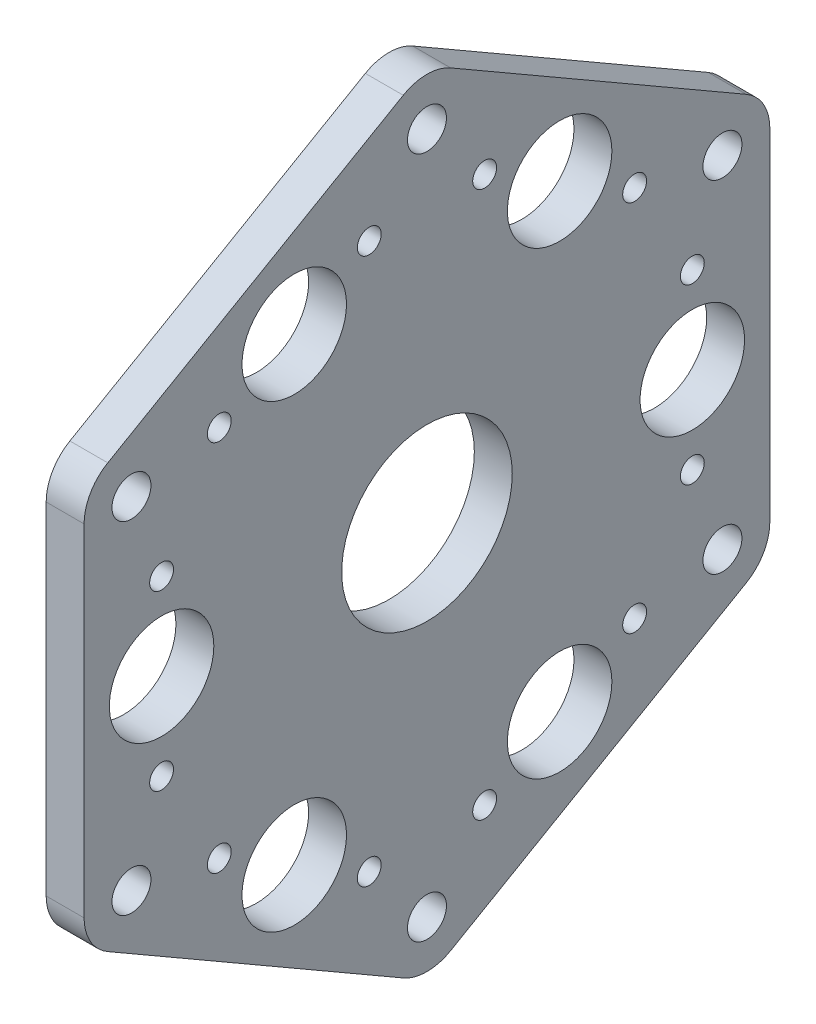
from build123d import *

# Parameters (mm, degrees)
SKETCH1_R           = 7.9375
SKETCH1_R_2         = 3.2639
BOSS_EXTRUDE1_DEPTH = 6.35
SKETCH2_R           = 14.2875
SKETCH2_R_2         = 2
SKETCH2_R_3         = 8.7503
CUT_EXTRUDE1_DEPTH  = 88.034521299


with BuildPart() as part:
    # Sketch1 → Boss-Extrude1 (new body)
    # profile 1 of 7: a face of its own
    with BuildSketch(Plane(origin=(0, 0, 0), x_dir=(0, 0, -1), z_dir=(1, 0, 0))):
        with BuildLine():
            ThreePointArc((-41.555851826, 28.575), (-49.493351826, 20.6375), (-57.430851826, 28.575))
            Line((-57.430851826, 28.575), (-57.430851826, -28.575))
            ThreePointArc((-57.430851826, -28.575), (-49.493351826, -20.6375), (-41.555851826, -28.575))
            ThreePointArc((-41.555851826, -28.575), (-45.524601826, -35.449076643), (-53.462101826, -35.449076643))
            Line((-53.462101826, -35.449076643), (-3.96875, -64.024076643))
            ThreePointArc((-3.96875, -64.024076643), (-3.96875, -50.275923357), (7.9375, -57.15))
            ThreePointArc((7.9375, -57.15), (6.874076643, -61.11875), (3.96875, -64.024076643))
            Line((3.96875, -64.024076643), (53.462101826, -35.449076643))
            ThreePointArc((53.462101826, -35.449076643), (42.619275184, -24.60625), (57.430851826, -28.575))
            Line((57.430851826, -28.575), (57.430851826, 28.575))
            ThreePointArc((57.430851826, 28.575), (42.619275184, 24.60625), (53.462101826, 35.449076643))
            Line((53.462101826, 35.449076643), (3.96875, 64.024076643))
            ThreePointArc((3.96875, 64.024076643), (6.874076643, 61.11875), (7.9375, 57.15))
            ThreePointArc((7.9375, 57.15), (-3.96875, 50.275923357), (-3.96875, 64.024076643))
            Line((-3.96875, 64.024076643), (-53.462101826, 35.449076643))
            ThreePointArc((-53.462101826, 35.449076643), (-45.524601826, 35.449076643), (-41.555851826, 28.575))
        make_face()
    # profile 2 of 7: a face of its own
    with BuildSketch(Plane(origin=(0, 0, 0), x_dir=(0, 0, -1), z_dir=(1, 0, 0))):
        with Locations((-49.493351826, 28.575)):
            Circle(SKETCH1_R)
        with Locations((-49.493351826, 28.575)):
            Circle(SKETCH1_R_2, mode=Mode.SUBTRACT)
    # profile 3 of 7: a face of its own
    with BuildSketch(Plane(origin=(0, 0, 0), x_dir=(0, 0, -1), z_dir=(1, 0, 0))):
        with Locations((-49.493351826, -28.575)):
            Circle(SKETCH1_R)
        with Locations((-49.493351826, -28.575)):
            Circle(SKETCH1_R_2, mode=Mode.SUBTRACT)
    # profile 4 of 7: a face of its own
    with BuildSketch(Plane(origin=(0, 0, 0), x_dir=(0, 0, -1), z_dir=(1, 0, 0))):
        with Locations((0, 57.15)):
            Circle(SKETCH1_R)
        with Locations((0, 57.15)):
            Circle(SKETCH1_R_2, mode=Mode.SUBTRACT)
    # profile 5 of 7: a face of its own
    with BuildSketch(Plane(origin=(0, 0, 0), x_dir=(0, 0, -1), z_dir=(1, 0, 0))):
        with Locations((49.493351826, 28.575)):
            Circle(SKETCH1_R)
        with Locations((49.493351826, 28.575)):
            Circle(SKETCH1_R_2, mode=Mode.SUBTRACT)
    # profile 6 of 7: a face of its own
    with BuildSketch(Plane(origin=(0, 0, 0), x_dir=(0, 0, -1), z_dir=(1, 0, 0))):
        with Locations((49.493351826, -28.575)):
            Circle(SKETCH1_R)
        with Locations((49.493351826, -28.575)):
            Circle(SKETCH1_R_2, mode=Mode.SUBTRACT)
    # profile 7 of 7: a face of its own
    with BuildSketch(Plane(origin=(0, 0, 0), x_dir=(0, 0, -1), z_dir=(1, 0, 0))):
        with Locations((0, -57.15)):
            Circle(SKETCH1_R)
        with Locations((0, -57.15)):
            Circle(SKETCH1_R_2, mode=Mode.SUBTRACT)
    extrude(amount=BOSS_EXTRUDE1_DEPTH)

    # Sketch2 → Cut-Extrude1 (cut, through all)
    with BuildSketch(Plane(origin=(0, 0, 0), x_dir=(0, 0, -1), z_dir=(1, 0, 0))):
        Circle(SKETCH2_R)
        with Locations((-34.785312841, -31.243129198)):
            Circle(SKETCH2_R_2)
        with Locations((-22.225, -38.494829198)):
            Circle(SKETCH2_R_3)
        with Locations((-9.664687159, -45.746529198)):
            Circle(SKETCH2_R_2)
        with Locations((9.664687159, -45.746529198)):
            Circle(SKETCH2_R_2)
        with Locations((34.785312841, -31.243129198)):
            Circle(SKETCH2_R_2)
        with Locations((22.225, -38.494829198)):
            Circle(SKETCH2_R_3)
        with Locations((44.45, -14.5034)):
            Circle(SKETCH2_R_2)
        with Locations((44.45, 0)):
            Circle(SKETCH2_R_3)
        with Locations((44.45, 14.5034)):
            Circle(SKETCH2_R_2)
        with Locations((34.785312841, 31.243129198)):
            Circle(SKETCH2_R_2)
        with Locations((9.664687159, 45.746529198)):
            Circle(SKETCH2_R_2)
        with Locations((-9.664687159, 45.746529198)):
            Circle(SKETCH2_R_2)
        with Locations((22.225, 38.494829198)):
            Circle(SKETCH2_R_3)
        with Locations((-34.785312841, 31.243129198)):
            Circle(SKETCH2_R_2)
        with Locations((-22.225, 38.494829198)):
            Circle(SKETCH2_R_3)
        with Locations((-44.45, -14.5034)):
            Circle(SKETCH2_R_2)
        with Locations((-44.45, 14.5034)):
            Circle(SKETCH2_R_2)
        with Locations((-44.45, 0)):
            Circle(SKETCH2_R_3)
    extrude(amount=CUT_EXTRUDE1_DEPTH, mode=Mode.SUBTRACT)


solid = part.part
